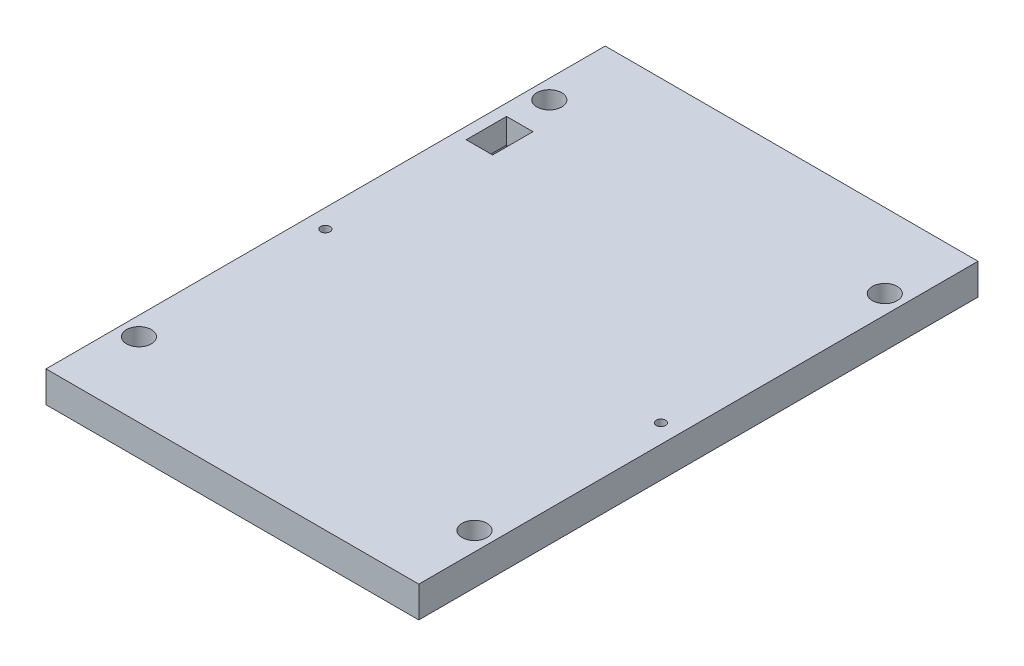
from build123d import *

# Parameters (mm, degrees)
SKETCH1_W           = 120
SKETCH1_H           = 180
BOSS_EXTRUDE1_DEPTH = 10
SKETCH2_R           = 4
SKETCH2_R_2         = 1.5
CUT_EXTRUDE1_DEPTH  = 10
SKETCH3_W           = 67
SKETCH3_H           = 54
SKETCH3_W_2         = 85
SKETCH3_H_2         = 41
SKETCH3_W_3         = 10.36
SKETCH3_H_3         = 14.7
CUT_EXTRUDE2_DEPTH  = 2
SKETCH4_W           = 8.5
SKETCH4_H           = 13
CUT_EXTRUDE3_DEPTH  = 10


with BuildPart() as part:
    # Sketch1 → Boss-Extrude1 (new body)
    with BuildSketch(Plane(origin=(0, 0, 0), x_dir=(1, 0, 0), z_dir=(0, 1, 0))):
        with Locations((-19.57251684, 15.427483158)):
            Rectangle(SKETCH1_W, SKETCH1_H)
    extrude(amount=BOSS_EXTRUDE1_DEPTH)

    # Sketch2 → Cut-Extrude1 (cut)
    with BuildSketch(Plane.XZ):
        with Locations(Location((-73.57251684, 50.65020927, 0), (0, 0, 270))):
            Circle(SKETCH2_R)
        with Locations(Location((34.42748316, 50.65020927, 0), (0, 0, 270))):
            Circle(SKETCH2_R)
        with Locations(Location((34.42748316, -81.427483158, 0), (0, 0, 270))):
            Circle(SKETCH2_R)
        with Locations(Location((-73.57251684, -81.427483158, 0), (0, 0, 270))):
            Circle(SKETCH2_R)
        with Locations(Location((-73.57251684, -9.34979073, 0), (0, 0, 270))):
            Circle(SKETCH2_R_2)
        with Locations(Location((34.42748316, -9.34979073, 0), (0, 0, 270))):
            Circle(SKETCH2_R_2)
    extrude(amount=-CUT_EXTRUDE1_DEPTH, mode=Mode.SUBTRACT)

    # Sketch3 → Cut-Extrude2 (cut)
    with BuildSketch(Plane.XZ):
        with Locations((-20.178258513, 45.076374251)):
            Rectangle(SKETCH3_W, SKETCH3_H)
        with Locations((-14.626073682, -76.328520248)):
            Rectangle(SKETCH3_W_2, SKETCH3_H_2)
        with Locations((-71.569507279, -63.427483158)):
            Rectangle(SKETCH3_W_3, SKETCH3_H_3)
    extrude(amount=-CUT_EXTRUDE2_DEPTH, mode=Mode.SUBTRACT)

    # Sketch4 → Cut-Extrude3 (cut)
    with BuildSketch(Plane.XZ):
        with Locations((-71.569507279, -63.427483158)):
            Rectangle(SKETCH4_W, SKETCH4_H)
    extrude(amount=-CUT_EXTRUDE3_DEPTH, mode=Mode.SUBTRACT)


solid = part.part
